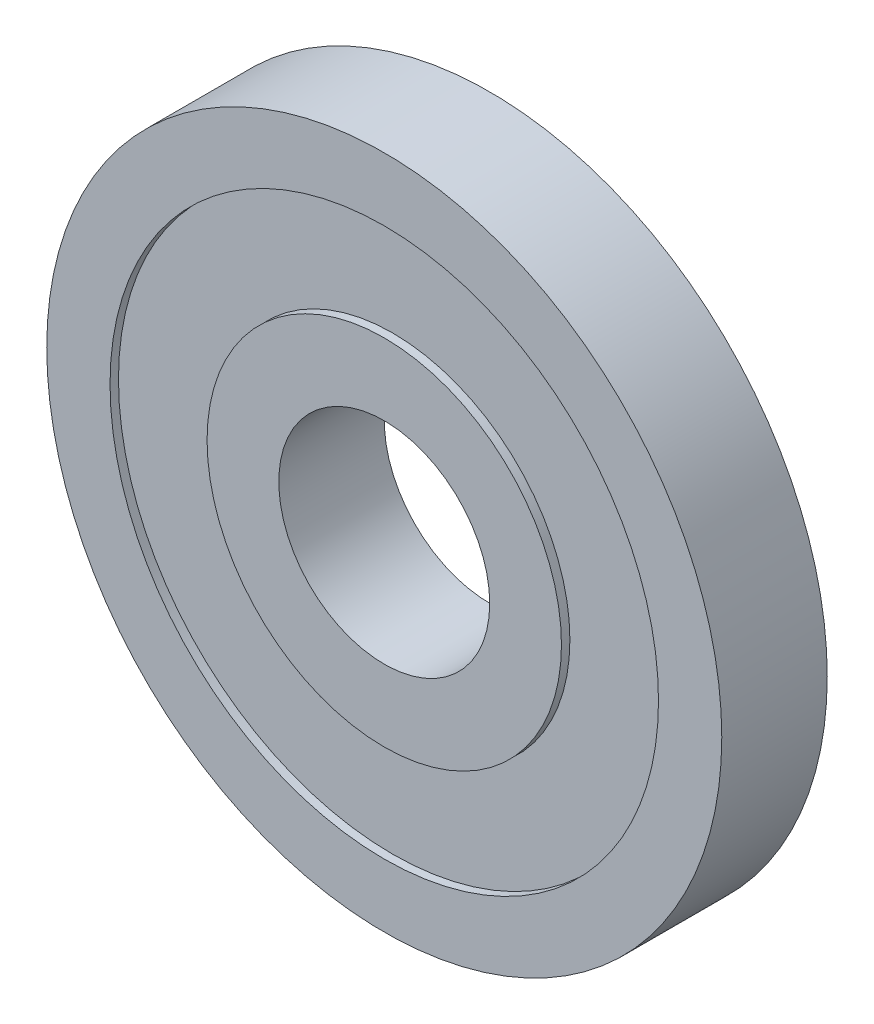
from build123d import *


with BuildPart() as part:
    # Croquis1 → Revolución1 (revolve)
    with BuildSketch(Plane(origin=(0, 0, 0), x_dir=(1, 0, 0), z_dir=(0, 1, 0))):
        Polygon((2.5, 2.3), (2.5, 2.5), (4.2, 2.5), (4.2, 2.3), (6.5, 2.3), (6.5, 2.5), (8, 2.5), (8, 0), (6.5, 0), (6.5, 0.2), (4.2, 0.2), (4.2, 0), (2.5, 0), align=None)
    revolve(axis=Axis((0, 0, 0), (0, 0, -1)))


solid = part.part
